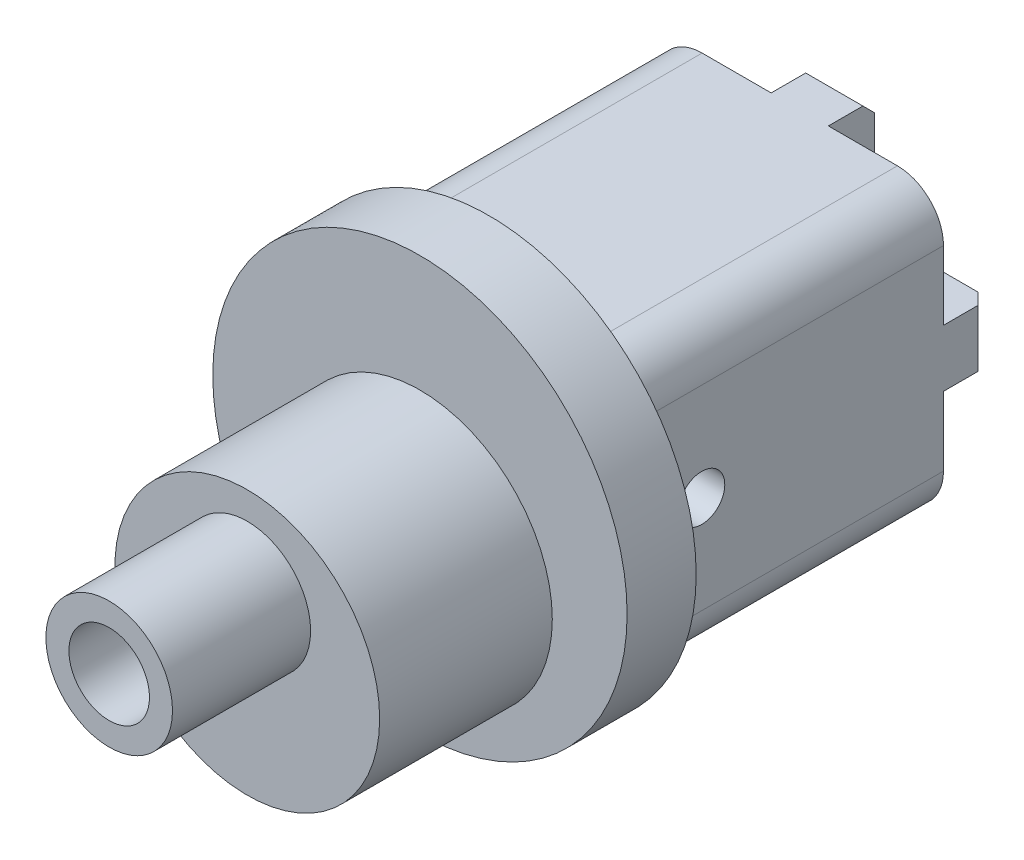
from build123d import *

# Parameters (mm, degrees)
BOSS_EXTRUDE3_START = 5.5
SKETCH3_R           = 9
BOSS_EXTRUDE3_DEPTH = 3
SKETCH4_R           = 5.75
BOSS_EXTRUDE4_DEPTH = 7.5
SKETCH5_R           = 2.75
BOSS_EXTRUDE5_DEPTH = 6
BOSS_EXTRUDE8_DEPTH = 2
BOSS_EXTRUDE9_START = 2
BOSS_EXTRUDE9_DEPTH = 13.5
SKETCH6_R           = 1
CUT_EXTRUDE1_DEPTH  = 15
CHAMFER1_SIZE       = 0.5
SKETCH7_R           = 1.75
CUT_EXTRUDE2_DEPTH  = 15


with BuildPart() as part:
    # Sketch3 → Boss-Extrude3 (new body)
    with BuildSketch(Plane.XY.offset(10).offset(BOSS_EXTRUDE3_START)):
        Circle(SKETCH3_R)
    extrude(amount=BOSS_EXTRUDE3_DEPTH)

    # Sketch4 → Boss-Extrude4 (add)
    with BuildSketch(Plane.XY.offset(18.5)):
        with Locations((0, -1.812)):
            Circle(SKETCH4_R)
    extrude(amount=BOSS_EXTRUDE4_DEPTH)

    # Sketch5 → Boss-Extrude5 (add)
    with BuildSketch(Plane.XY.offset(26)):
        Circle(SKETCH5_R)
    extrude(amount=BOSS_EXTRUDE5_DEPTH)



with BuildPart() as body_2:
    # Sketch1 → Boss-Extrude8 (new body)
    with BuildSketch(Plane.XY):
        with BuildLine():
            Line((1.242640687, 4.242640687), (1.242640687, 6.242640687))
            Line((1.242640687, 6.242640687), (-1.242640687, 6.242640687))
            Line((-1.242640687, 6.242640687), (-1.242640687, 4.242640687))
            ThreePointArc((-1.242640687, 4.242640687), (-2.121320344, 2.121320343), (-4.242640687, 1.242640687))
            Line((-4.242640687, 1.242640687), (-6.242640687, 1.242640687))
            Line((-6.242640687, 1.242640687), (-6.242640687, -1.242640687))
            Line((-6.242640687, -1.242640687), (-4.242640687, -1.242640687))
            ThreePointArc((-4.242640687, -1.242640687), (-2.121320343, -2.121320344), (-1.242640687, -4.242640687))
            Line((-1.242640687, -4.242640687), (-1.242640687, -6.242640687))
            Line((-1.242640687, -6.242640687), (1.242640687, -6.242640687))
            Line((1.242640687, -6.242640687), (1.242640687, -4.242640687))
            ThreePointArc((1.242640687, -4.242640687), (2.121320344, -2.121320343), (4.242640687, -1.242640687))
            Line((4.242640687, -1.242640687), (6.242640687, -1.242640687))
            Line((6.242640687, -1.242640687), (6.242640687, 1.242640687))
            Line((6.242640687, 1.242640687), (4.242640687, 1.242640687))
            ThreePointArc((4.242640687, 1.242640687), (2.121320343, 2.121320344), (1.242640687, 4.242640687))
        make_face()
    extrude(amount=BOSS_EXTRUDE8_DEPTH)


with BuildPart() as part_1:
    add(part.part)

    add(body_2.part)  # Boss-Extrude9 merges body 2
    # Sketch1<7> → Boss-Extrude9 (add)
    with BuildSketch(Plane.XY.offset(BOSS_EXTRUDE9_START)):
        with BuildLine():
            Line((4.242640687, 6.242640687), (-4.242640687, 6.242640687))
            ThreePointArc((-4.242640687, 6.242640687), (-5.656854249, 5.656854249), (-6.242640687, 4.242640687))
            Line((-6.242640687, 4.242640687), (-6.242640687, -4.242640687))
            ThreePointArc((-6.242640687, -4.242640687), (-5.656854249, -5.656854249), (-4.242640687, -6.242640686))
            Line((-4.242640687, -6.242640687), (4.242640687, -6.242640687))
            ThreePointArc((4.242640687, -6.242640686), (5.656854249, -5.656854249), (6.242640686, -4.242640687))
            Line((6.242640687, -4.242640687), (6.242640687, 4.242640687))
            ThreePointArc((6.242640687, 4.242640687), (5.656854249, 5.656854249), (4.242640687, 6.242640687))
        make_face()
    extrude(amount=BOSS_EXTRUDE9_DEPTH)

    # Sketch6 → Cut-Extrude1 (cut)
    with BuildSketch(Plane(origin=(6.242640687, 0, 0), x_dir=(0, 0, -1), z_dir=(1, 0, 0))):
        with Locations((-12.5, 0)):
            Circle(SKETCH6_R)
    extrude(amount=-CUT_EXTRUDE1_DEPTH, mode=Mode.SUBTRACT)

    # Chamfer1
    chamfer1_edges = [part_1.edges().sort_by_distance(p)[0] for p in [
        (0, -6.242640687, 0),
        (6.242640687, 0, 0),
        (-6.242640687, 0, 0),
        (0, 6.242640687, 0),
    ]]
    chamfer(chamfer1_edges, length=CHAMFER1_SIZE)

    # Sketch7 → Cut-Extrude2 (cut)
    with BuildSketch(Plane.XY.offset(32)):
        Circle(SKETCH7_R)
    extrude(amount=-CUT_EXTRUDE2_DEPTH, mode=Mode.SUBTRACT)


solid = part_1.part
